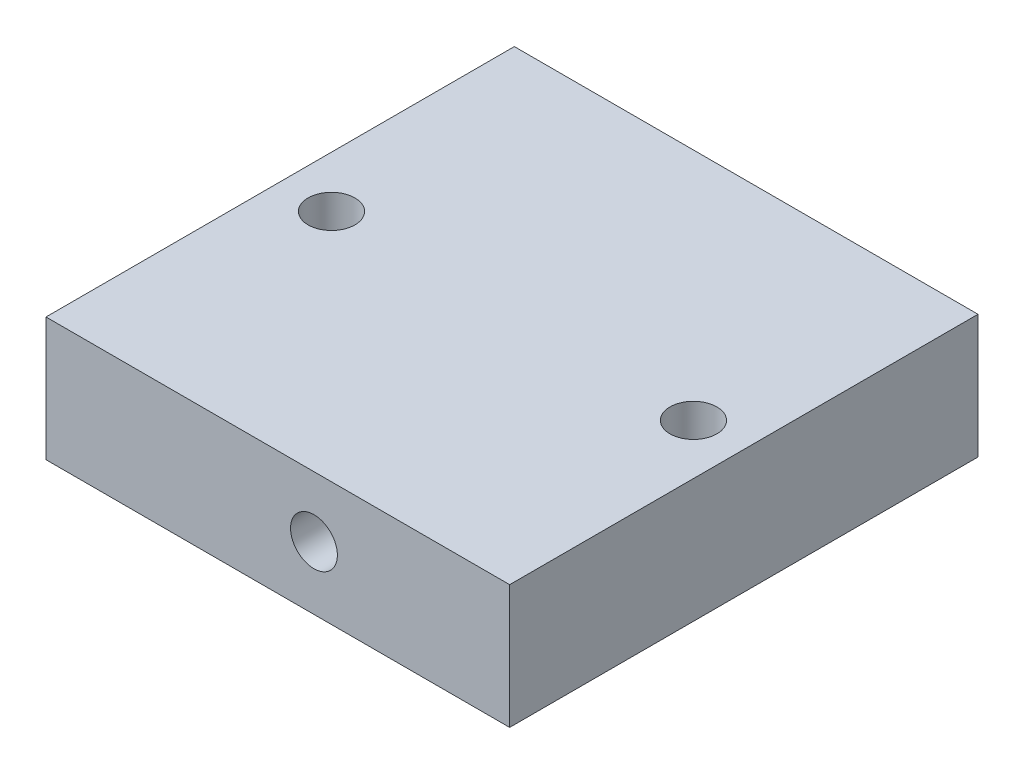
from build123d import *

# Parameters (mm, degrees)
SKETCH2_W        = 495
SKETCH2_H        = 500
HIPS_DEPTH       = 132
SKETCH3_R        = 25
FEMUR_HOLE_DEPTH = 574.306418942
SKETCH4_R        = 25
TAIL_HOLE_DEPTH  = 376.739603981
SKETCH5_R        = 25
NECK_HOLE_DEPTH  = 376.739603981


with BuildPart() as part:
    # Sketch2 → Hips (new body)
    with BuildSketch(Plane(origin=(0, 0, 0), x_dir=(1, 0, 0), z_dir=(0, 1, 0))):
        Rectangle(SKETCH2_W, SKETCH2_H)
    extrude(amount=HIPS_DEPTH)

    # Sketch3 → Femur-hole (cut, through all)
    with BuildSketch(Plane.XY.offset(250)):
        with Locations((38.58686963, 67.285203145)):
            Circle(SKETCH3_R)
    extrude(amount=-FEMUR_HOLE_DEPTH, mode=Mode.SUBTRACT)

    # Sketch4 → Tail-hole (cut, through all)
    with BuildSketch(Plane.XZ):
        with Locations(Location((193.717960243, 0, 0), (0, 0, 270))):
            Circle(SKETCH4_R)
    extrude(amount=-TAIL_HOLE_DEPTH, mode=Mode.SUBTRACT)

    # Sketch5 → Neck-hole (cut, through all)
    with BuildSketch(Plane.XZ):
        with Locations(Location((-192.698108673, 0, 0), (0, 0, 270))):
            Circle(SKETCH5_R)
    extrude(amount=-NECK_HOLE_DEPTH, mode=Mode.SUBTRACT)


solid = part.part
